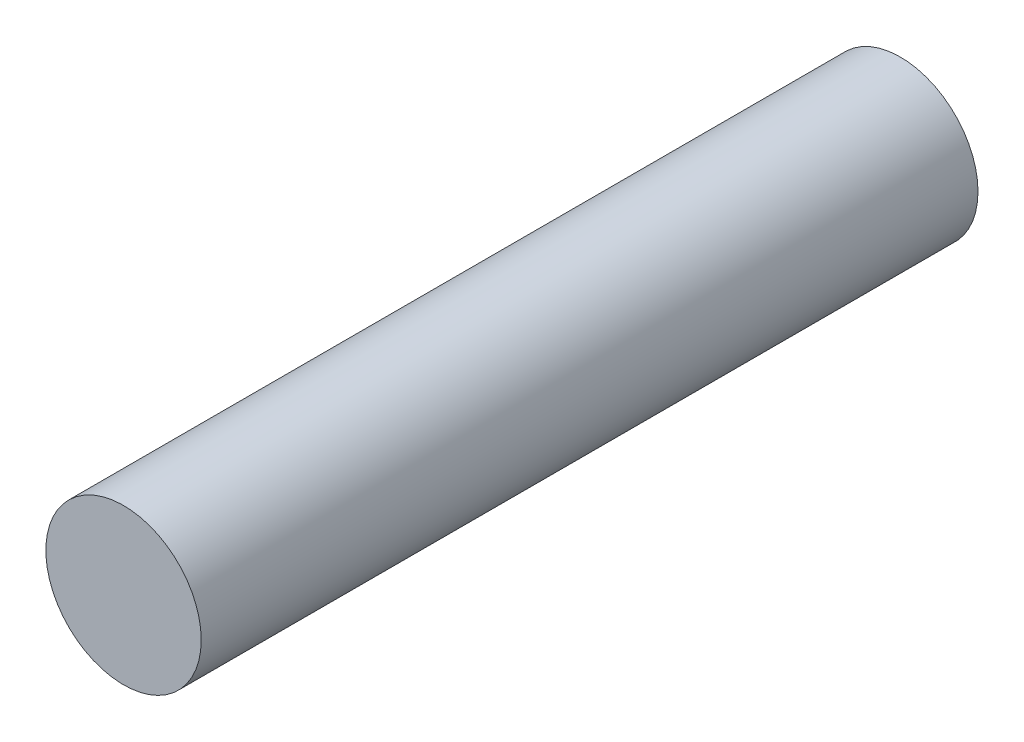
from build123d import *

# Parameters (mm, degrees)
SKETCH1_R           = 1
BOSS_EXTRUDE2_DEPTH = 5


with BuildPart() as part:
    # Sketch1 → Boss-Extrude2 (new, symmetric)
    with BuildSketch(Plane.XY):
        Circle(SKETCH1_R)
    extrude(amount=BOSS_EXTRUDE2_DEPTH, both=True)


solid = part.part
